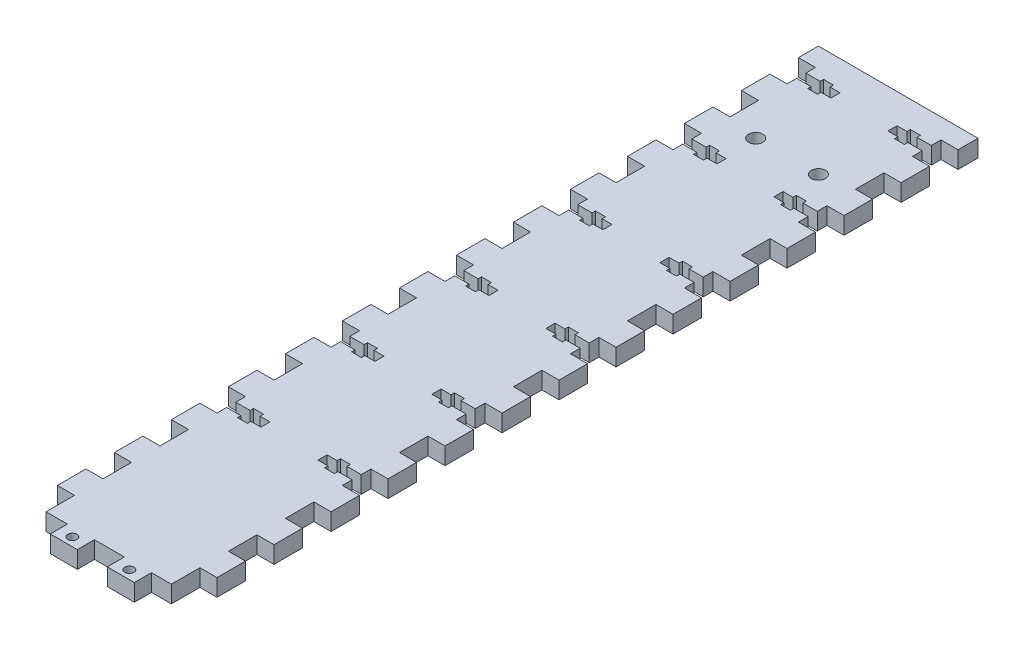
from build123d import *

# Parameters (mm, degrees)
SKETCH1_W           = 56
SKETCH1_H           = 6
BOSS_EXTRUDE1_DEPTH = 277
SKETCH3_W           = 6
SKETCH3_H           = 10
CUT_EXTRUDE1_DEPTH  = 291.029245391
SKETCH6_W           = 9.5
SKETCH6_H           = 6
BOSS_EXTRUDE2_DEPTH = 6
SKETCH9_W           = 3.2
SKETCH9_H           = 6
CUT_EXTRUDE2_DEPTH  = 12
SKETCH10_W          = 3.2
SKETCH10_H          = 6
CUT_EXTRUDE3_DEPTH  = 12
SKETCH11_W          = 3.5
SKETCH11_H          = 5.6
CUT_EXTRUDE4_DEPTH  = 12
SKETCH12_R          = 1.6
CUT_EXTRUDE5_DEPTH  = 12
SKETCH17_W          = 44
SKETCH17_H          = 10
BOSS_EXTRUDE5_DEPTH = 6
SKETCH15_R          = 2.5
CUT_EXTRUDE7_DEPTH  = 296.765047262


with BuildPart() as part:
    # Sketch1 → Boss-Extrude1 (new body)
    with BuildSketch(Plane.XY):
        with Locations((-57.743589744, 27.128205128)):
            Rectangle(SKETCH1_W, SKETCH1_H)
    extrude(amount=BOSS_EXTRUDE1_DEPTH)

    # Sketch3 → Cut-Extrude1 (cut, through all)
    with BuildSketch(Plane(origin=(0, 30.128205128, 0), x_dir=(1, 0, 0), z_dir=(0, 1, 0))):
        with Locations((-82.743589744, -272)):
            Rectangle(SKETCH3_W, SKETCH3_H)
        with Locations((-32.743589744, -272)):
            Rectangle(SKETCH3_W, SKETCH3_H)
        with Locations((-82.743589744, -252)):
            Rectangle(SKETCH3_W, SKETCH3_H)
        with Locations((-32.743589744, -252)):
            Rectangle(SKETCH3_W, SKETCH3_H)
        with Locations((-82.743589744, -232)):
            Rectangle(SKETCH3_W, SKETCH3_H)
        with Locations((-32.743589744, -232)):
            Rectangle(SKETCH3_W, SKETCH3_H)
        with Locations((-82.743589744, -212)):
            Rectangle(SKETCH3_W, SKETCH3_H)
        with Locations((-32.743589744, -212)):
            Rectangle(SKETCH3_W, SKETCH3_H)
        with Locations((-82.743589744, -192)):
            Rectangle(SKETCH3_W, SKETCH3_H)
        with Locations((-32.743589744, -192)):
            Rectangle(SKETCH3_W, SKETCH3_H)
        with Locations((-82.743589744, -172)):
            Rectangle(SKETCH3_W, SKETCH3_H)
        with Locations((-32.743589744, -172)):
            Rectangle(SKETCH3_W, SKETCH3_H)
        with Locations((-82.743589744, -152)):
            Rectangle(SKETCH3_W, SKETCH3_H)
        with Locations((-32.743589744, -152)):
            Rectangle(SKETCH3_W, SKETCH3_H)
        with Locations((-82.743589744, -132)):
            Rectangle(SKETCH3_W, SKETCH3_H)
        with Locations((-32.743589744, -132)):
            Rectangle(SKETCH3_W, SKETCH3_H)
        with Locations((-82.743589744, -112)):
            Rectangle(SKETCH3_W, SKETCH3_H)
        with Locations((-32.743589744, -112)):
            Rectangle(SKETCH3_W, SKETCH3_H)
        with Locations((-82.743589744, -92)):
            Rectangle(SKETCH3_W, SKETCH3_H)
        with Locations((-32.743589744, -92)):
            Rectangle(SKETCH3_W, SKETCH3_H)
        with Locations((-82.743589744, -72)):
            Rectangle(SKETCH3_W, SKETCH3_H)
        with Locations((-32.743589744, -72)):
            Rectangle(SKETCH3_W, SKETCH3_H)
        with Locations((-82.743589744, -52)):
            Rectangle(SKETCH3_W, SKETCH3_H)
        with Locations((-32.743589744, -52)):
            Rectangle(SKETCH3_W, SKETCH3_H)
        with Locations((-82.743589744, -32)):
            Rectangle(SKETCH3_W, SKETCH3_H)
        with Locations((-32.743589744, -32)):
            Rectangle(SKETCH3_W, SKETCH3_H)
        with Locations((-82.743589744, -12)):
            Rectangle(SKETCH3_W, SKETCH3_H)
        with Locations((-32.743589744, -12)):
            Rectangle(SKETCH3_W, SKETCH3_H)
    extrude(amount=-CUT_EXTRUDE1_DEPTH, mode=Mode.SUBTRACT)

    # Sketch6 → Boss-Extrude2 (add)
    with BuildSketch(Plane.XY.offset(277)):
        with Locations((-67.493589744, 27.128205128)):
            Rectangle(SKETCH6_W, SKETCH6_H)
        with Locations((-47.493589744, 27.128205128)):
            Rectangle(SKETCH6_W, SKETCH6_H)
    extrude(amount=BOSS_EXTRUDE2_DEPTH)

    # Sketch9 → Cut-Extrude2 (cut)
    with BuildSketch(Plane(origin=(-35.743589744, 0, 0), x_dir=(0, 0, -1), z_dir=(1, 0, 0))):
        with Locations((-252, 27.128205128)):
            Rectangle(SKETCH9_W, SKETCH9_H)
        with Locations((-212, 27.128205128)):
            Rectangle(SKETCH9_W, SKETCH9_H)
        with Locations((-172, 27.128205128)):
            Rectangle(SKETCH9_W, SKETCH9_H)
        with Locations((-132, 27.128205128)):
            Rectangle(SKETCH9_W, SKETCH9_H)
        with Locations((-92, 27.128205128)):
            Rectangle(SKETCH9_W, SKETCH9_H)
        with Locations((-52, 27.128205128)):
            Rectangle(SKETCH9_W, SKETCH9_H)
        with Locations((-12, 27.128205128)):
            Rectangle(SKETCH9_W, SKETCH9_H)
    extrude(amount=-CUT_EXTRUDE2_DEPTH, mode=Mode.SUBTRACT)

    # Sketch10 → Cut-Extrude3 (cut)
    with BuildSketch(Plane.ZY.offset(79.743589744)):
        with Locations((252, 27.128205128)):
            Rectangle(SKETCH10_W, SKETCH10_H)
        with Locations((212, 27.128205128)):
            Rectangle(SKETCH10_W, SKETCH10_H)
        with Locations((172, 27.128205128)):
            Rectangle(SKETCH10_W, SKETCH10_H)
        with Locations((132, 27.128205128)):
            Rectangle(SKETCH10_W, SKETCH10_H)
        with Locations((92, 27.128205128)):
            Rectangle(SKETCH10_W, SKETCH10_H)
        with Locations((52, 27.128205128)):
            Rectangle(SKETCH10_W, SKETCH10_H)
        with Locations((12, 27.128205128)):
            Rectangle(SKETCH10_W, SKETCH10_H)
    extrude(amount=-CUT_EXTRUDE3_DEPTH, mode=Mode.SUBTRACT)

    # Sketch11 → Cut-Extrude4 (cut)
    with BuildSketch(Plane.XZ.offset(-24.128205128)):
        with Locations((-72.993589744, 252)):
            Rectangle(SKETCH11_W, SKETCH11_H)
        with Locations((-42.493589744, 252)):
            Rectangle(SKETCH11_W, SKETCH11_H)
        with Locations((-72.993589744, 212)):
            Rectangle(SKETCH11_W, SKETCH11_H)
        with Locations((-42.493589744, 212)):
            Rectangle(SKETCH11_W, SKETCH11_H)
        with Locations((-72.993589744, 172)):
            Rectangle(SKETCH11_W, SKETCH11_H)
        with Locations((-42.493589744, 172)):
            Rectangle(SKETCH11_W, SKETCH11_H)
        with Locations((-72.993589744, 132)):
            Rectangle(SKETCH11_W, SKETCH11_H)
        with Locations((-42.493589744, 132)):
            Rectangle(SKETCH11_W, SKETCH11_H)
        with Locations((-72.993589744, 92)):
            Rectangle(SKETCH11_W, SKETCH11_H)
        with Locations((-42.493589744, 92)):
            Rectangle(SKETCH11_W, SKETCH11_H)
        with Locations((-72.993589744, 52)):
            Rectangle(SKETCH11_W, SKETCH11_H)
        with Locations((-42.493589744, 52)):
            Rectangle(SKETCH11_W, SKETCH11_H)
        with Locations((-72.993589744, 12)):
            Rectangle(SKETCH11_W, SKETCH11_H)
        with Locations((-42.493589744, 12)):
            Rectangle(SKETCH11_W, SKETCH11_H)
    extrude(amount=-CUT_EXTRUDE4_DEPTH, mode=Mode.SUBTRACT)

    # Sketch12 → Cut-Extrude5 (cut)
    with BuildSketch(Plane.XZ.offset(-24.128205128)):
        with Locations(Location((-67.493589744, 280, 0), (0, 0, 270))):
            Circle(SKETCH12_R)
        with Locations(Location((-47.493589744, 280, 0), (0, 0, 270))):
            Circle(SKETCH12_R)
    extrude(amount=-CUT_EXTRUDE5_DEPTH, mode=Mode.SUBTRACT)

    # Sketch17 → Boss-Extrude5 (add, through all)
    with BuildSketch(Plane(origin=(0, 30.128205128, 0), x_dir=(1, 0, 0), z_dir=(0, 1, 0))):
        with Locations((-57.743589744, -252)):
            Rectangle(SKETCH17_W, SKETCH17_H)
    extrude(amount=-BOSS_EXTRUDE5_DEPTH)

    # Sketch15 → Cut-Extrude7 (cut, through all)
    with BuildSketch(Plane.XZ.offset(-24.128205128)):
        with Locations(Location((-68.743589744, 39, 0), (0, 0, 270))):
            Circle(SKETCH15_R)
        with Locations(Location((-46.743589744, 39, 0), (0, 0, 90))):
            Circle(SKETCH15_R)
    extrude(amount=-CUT_EXTRUDE7_DEPTH, mode=Mode.SUBTRACT)


solid = part.part
